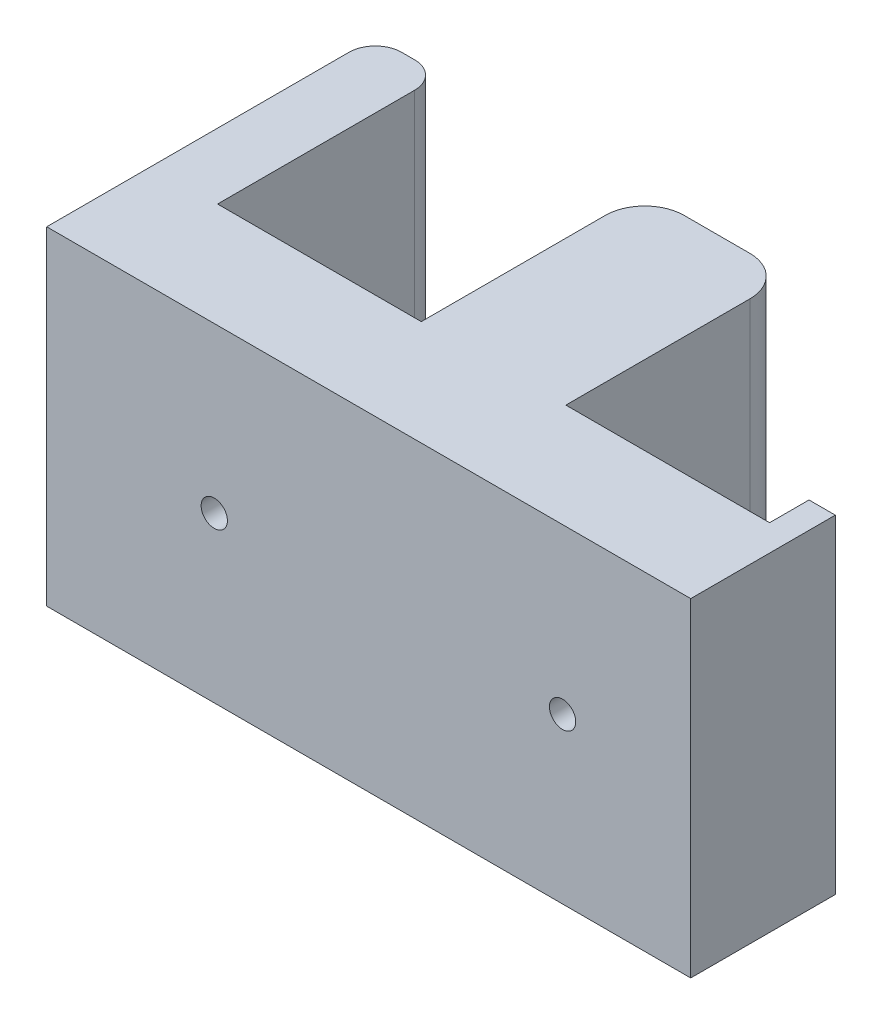
from build123d import *

# Parameters (mm, degrees)
BOSS_EXTRUDE1_DEPTH = 25
FILLET2_R           = 3
FILLET3_R           = 2
SKETCH3_R           = 1
CUT_EXTRUDE1_DEPTH  = 58.576036682


with BuildPart() as part:
    # Sketch1 → Boss-Extrude1 (new body)
    with BuildSketch(Plane(origin=(0, 0, 0), x_dir=(1, 0, 0), z_dir=(0, 1, 0))):
        Polygon((0, 0), (49, 0), (49, 11), (47, 11), (47, 8), (31.5, 8), (31.5, 25), (20.5, 25), (20.5, 8), (5, 8), (5, 25), (0, 25), align=None)
    extrude(amount=BOSS_EXTRUDE1_DEPTH)

    # Fillet2
    fillet2_edges = [part.edges().sort_by_distance(p)[0] for p in [
        (20.5, 12.5, -25),
        (31.5, 12.5, -25),
    ]]
    fillet(fillet2_edges, radius=FILLET2_R)

    # Fillet3
    fillet3_edges = [part.edges().sort_by_distance(p)[0] for p in [
        (0, 12.5, -25),
        (5, 12.5, -25),
    ]]
    fillet(fillet3_edges, radius=FILLET3_R)

    # Sketch3 → Cut-Extrude1 (cut, through all)
    with BuildSketch(Plane(origin=(0, 0, -8), x_dir=(-1, 0, 0), z_dir=(0, 0, -1))):
        with Locations((-39.25, 12.5)):
            Circle(SKETCH3_R)
        with Locations((-12.75, 12.5)):
            Circle(SKETCH3_R)
    extrude(amount=-CUT_EXTRUDE1_DEPTH, mode=Mode.SUBTRACT)


solid = part.part
